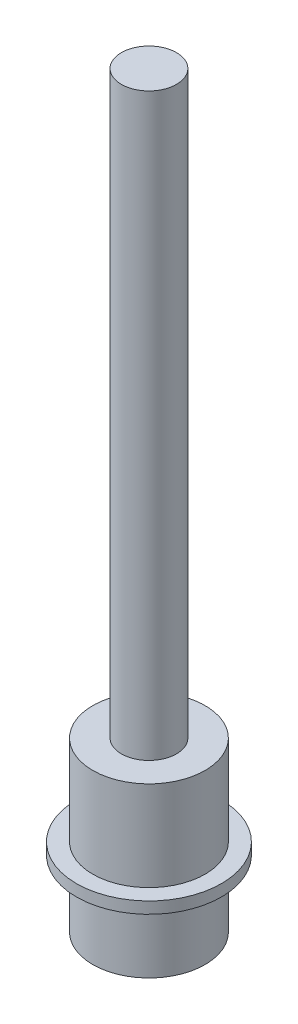
from build123d import *

# Parameters (mm, degrees)
SKETCH1_R           = 4.845
SKETCH1_R_2         = 2.375
BOSS_EXTRUDE1_DEPTH = 5.75
SKETCH4_R           = 6.25
SKETCH4_R_2         = 2.375
BOSS_EXTRUDE4_DEPTH = 1
SKETCH5_R           = 4.845
SKETCH5_R_2         = 2.375
BOSS_EXTRUDE5_DEPTH = 5.75
SKETCH6_R           = 4.845
BOSS_EXTRUDE6_DEPTH = 2
SKETCH7_R           = 2.375
BOSS_EXTRUDE7_DEPTH = 50


with BuildPart() as part:
    # Sketch1 → Boss-Extrude1 (new body)
    with BuildSketch(Plane(origin=(0, 0, 0), x_dir=(1, 0, 0), z_dir=(0, 1, 0))):
        with Locations(Location((0, 0, 0), (0, 0, 270))):
            Circle(SKETCH1_R)
        with Locations(Location((0, 0, 0), (0, 0, 270))):
            Circle(SKETCH1_R_2, mode=Mode.SUBTRACT)
    extrude(amount=BOSS_EXTRUDE1_DEPTH)

    # Sketch4 → Boss-Extrude4 (add)
    with BuildSketch(Plane(origin=(0, 5.75, 0), x_dir=(1, 0, 0), z_dir=(0, 1, 0))):
        with Locations(Location((0, 0, 0), (0, 0, 270))):
            Circle(SKETCH4_R)
        with Locations(Location((0, 0, 0), (0, 0, 270))):
            Circle(SKETCH4_R_2, mode=Mode.SUBTRACT)
    extrude(amount=BOSS_EXTRUDE4_DEPTH)

    # Sketch5 → Boss-Extrude5 (add)
    with BuildSketch(Plane(origin=(0, 6.75, 0), x_dir=(1, 0, 0), z_dir=(0, 1, 0))):
        with Locations(Location((0, 0, 0), (0, 0, 270))):
            Circle(SKETCH5_R)
        with Locations(Location((0, 0, 0), (0, 0, 270))):
            Circle(SKETCH5_R_2, mode=Mode.SUBTRACT)
    extrude(amount=BOSS_EXTRUDE5_DEPTH)

    # Sketch6 → Boss-Extrude6 (add)
    with BuildSketch(Plane(origin=(0, 12.5, 0), x_dir=(1, 0, 0), z_dir=(0, 1, 0))):
        with Locations(Location((0, 0, 0), (0, 0, 270))):
            Circle(SKETCH6_R)
    extrude(amount=BOSS_EXTRUDE6_DEPTH)

    # Sketch7 → Boss-Extrude7 (add)
    with BuildSketch(Plane(origin=(0, 14.5, 0), x_dir=(1, 0, 0), z_dir=(0, 1, 0))):
        with Locations(Location((0, 0, 0), (0, 0, 270))):
            Circle(SKETCH7_R)
    extrude(amount=BOSS_EXTRUDE7_DEPTH)


solid = part.part
